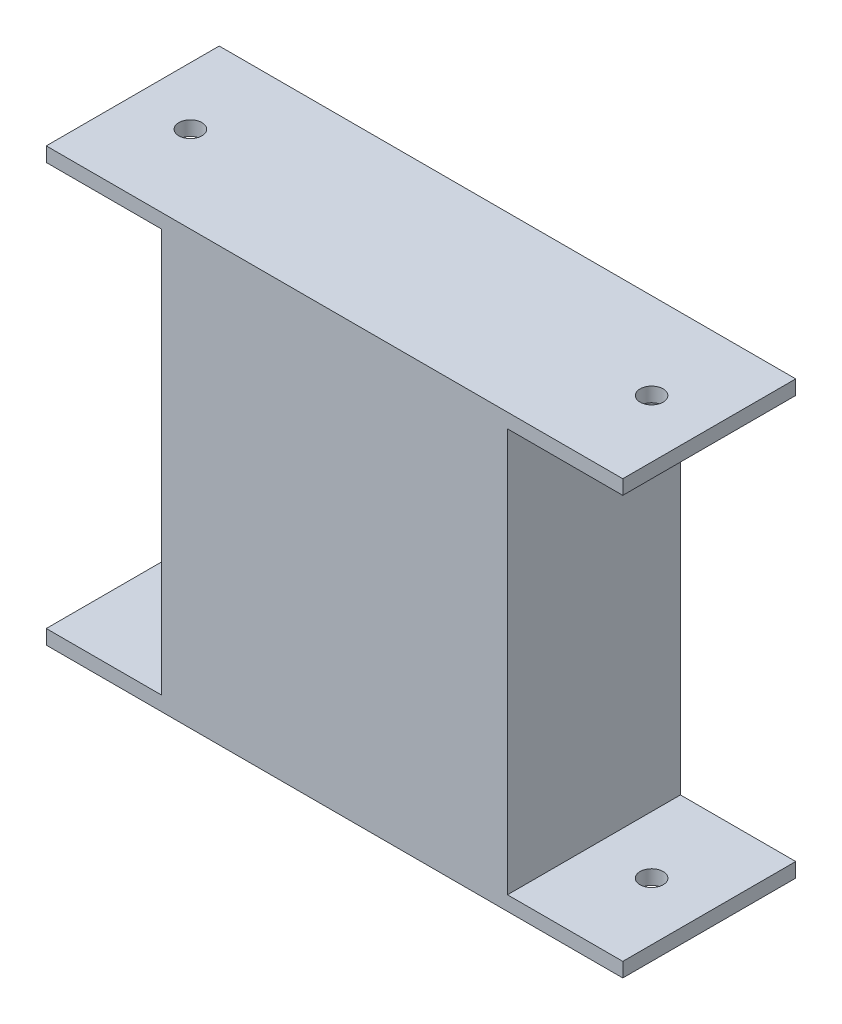
from build123d import *

# Parameters (mm, degrees)
EXTRUDE_1_DEPTH     = 60
SKETCH_4_R          = 4
CUT_EXTRUDE_3_DEPTH = 198


with BuildPart() as part:
    # 草图1 → 凸台-拉伸1 (new body)
    with BuildSketch(Plane.XY):
        Polygon((-100, 75), (100, 75), (100, 70), (60, 70), (60, -70), (100, -70), (100, -75), (-100, -75), (-100, -70), (-60, -70), (-60, 70), (-100, 70), align=None)
    extrude(amount=EXTRUDE_1_DEPTH)

    # 草图4 → 切除-拉伸3 (cut)
    with BuildSketch(Plane.XZ.offset(75)):
        with Locations(Location((-80, 30, 0), (0, 0, 270))):
            Circle(SKETCH_4_R)
        with Locations(Location((80, 30, 0), (0, 0, 270))):
            Circle(SKETCH_4_R)
    extrude(amount=-CUT_EXTRUDE_3_DEPTH, mode=Mode.SUBTRACT)


solid = part.part
